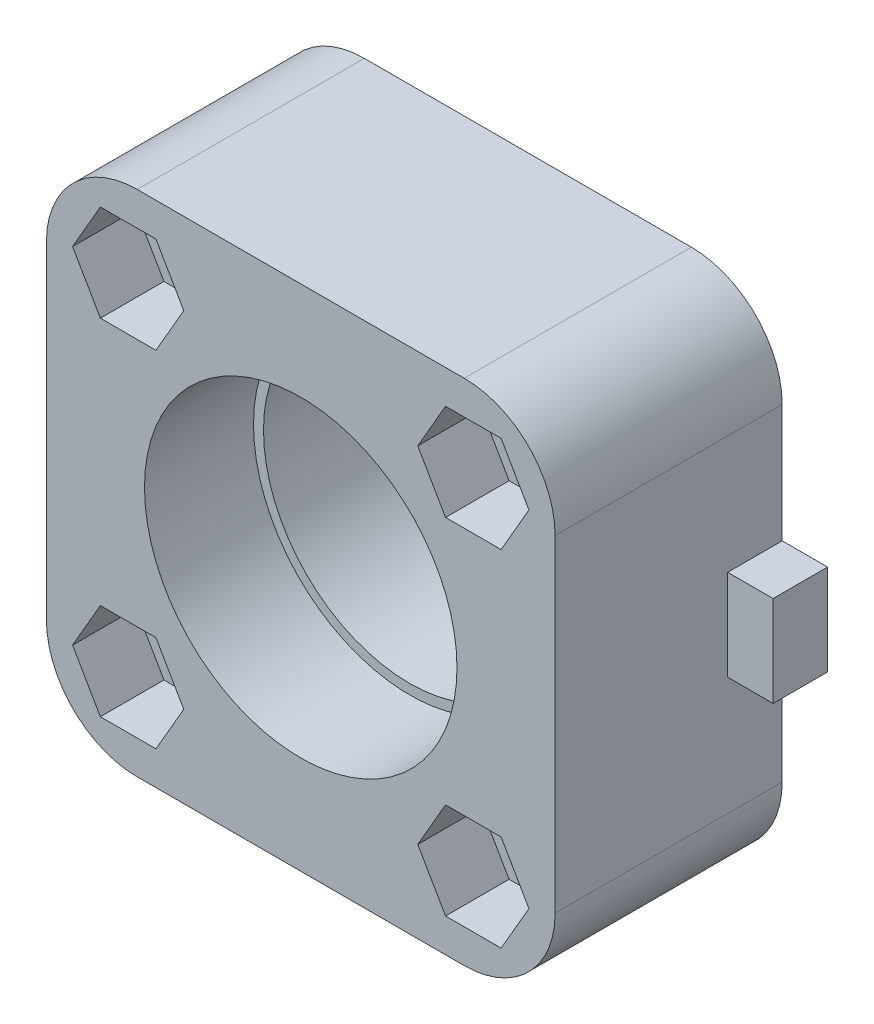
from build123d import *

# Parameters (mm, degrees)
CROQUIS1_W              = 28
CROQUIS1_H              = 28
CROQUIS1_R              = 8.05
SALIENTE_EXTRUIR1_DEPTH = 3.25
CROQUIS2_W              = 28
CROQUIS2_H              = 28
CROQUIS2_R              = 8.6
SALIENTE_EXTRUIR2_DEPTH = 6
CORTAR_EXTRUIR1_DEPTH   = 3.5
CROQUIS6_R              = 1.5
CORTAR_EXTRUIR2_DEPTH   = 23.5
CROQUIS7_W              = 2.5
CROQUIS7_H              = 5
CROQUIS7_W_2            = 10
CROQUIS7_H_2            = 4
SALIENTE_EXTRUIR3_DEPTH = 3
REDONDEO1_R             = 5


with BuildPart() as part:
    # Croquis1 → Saliente-Extruir1 (new, symmetric)
    with BuildSketch(Plane.XY):
        Rectangle(CROQUIS1_W, CROQUIS1_H)
        with Locations(Location((0, 0, 0), (0, 0, 180))):
            Circle(CROQUIS1_R, mode=Mode.SUBTRACT)
    extrude(amount=SALIENTE_EXTRUIR1_DEPTH, both=True)

    # Croquis2 → Saliente-Extruir2 (add)
    with BuildSketch(Plane.XY.offset(3.25)):
        Rectangle(CROQUIS2_W, CROQUIS2_H)
        Circle(CROQUIS2_R, mode=Mode.SUBTRACT)
    extrude(amount=SALIENTE_EXTRUIR2_DEPTH)

    # Croquis3 → Cortar-Extruir1 (cut)
    with BuildSketch(Plane.XY.offset(9.25)):
        Polygon((11.029978213, 12.15), (7.970021787, 12.15), (6.440043573, 9.5), (7.970021787, 6.85), (11.029978213, 6.85), (12.559956427, 9.5), align=None)
        Polygon((-6.440043573, 9.5), (-7.970021787, 12.15), (-11.029978213, 12.15), (-12.559956427, 9.5), (-11.029978213, 6.85), (-7.970021787, 6.85), align=None)
        Polygon((-7.970021787, -6.85), (-11.029978213, -6.85), (-12.559956427, -9.5), (-11.029978213, -12.15), (-7.970021787, -12.15), (-6.440043573, -9.5), align=None)
        Polygon((11.029978213, -6.85), (7.970021787, -6.85), (6.440043573, -9.5), (7.970021787, -12.15), (11.029978213, -12.15), (12.559956427, -9.5), align=None)
    extrude(amount=-CORTAR_EXTRUIR1_DEPTH, mode=Mode.SUBTRACT)

    # Croquis6 → Cortar-Extruir2 (cut)
    with BuildSketch(Plane(origin=(0, 0, -3.25), x_dir=(-1, 0, 0), z_dir=(0, 0, -1))):
        with Locations((-9.5, 9.5)):
            Circle(CROQUIS6_R)
        with Locations((9.5, 9.5)):
            Circle(CROQUIS6_R)
        with Locations((9.5, -9.5)):
            Circle(CROQUIS6_R)
        with Locations((-9.5, -9.5)):
            Circle(CROQUIS6_R)
    extrude(amount=-CORTAR_EXTRUIR2_DEPTH, mode=Mode.SUBTRACT)

    # Croquis7 → Saliente-Extruir3 (add)
    with BuildSketch(Plane(origin=(0, 0, -3.25), x_dir=(-1, 0, 0), z_dir=(0, 0, -1))):
        Polygon((14, 5.5), (14, 2.5), (16.5, 2.5), (18.9, 2.5), (18.9, 5.5), align=None)
        with Locations((15.25, 0)):
            Rectangle(CROQUIS7_W, CROQUIS7_H)
        Polygon((14, -2.5), (14, -5.5), (18.9, -5.5), (18.9, -2.5), (16.5, -2.5), align=None)
        with Locations((0, -16)):
            Rectangle(CROQUIS7_W_2, CROQUIS7_H_2)
        with Locations((-15.25, 0)):
            Rectangle(CROQUIS7_W, CROQUIS7_H)
    extrude(amount=-SALIENTE_EXTRUIR3_DEPTH)

    # Redondeo1
    redondeo1_edges = [part.edges().sort_by_distance(p)[0] for p in [
        (14, -14, 3),
        (-14, -14, 3),
        (-14, 14, 3),
        (14, 14, 3),
    ]]
    fillet(redondeo1_edges, radius=REDONDEO1_R)


solid = part.part
